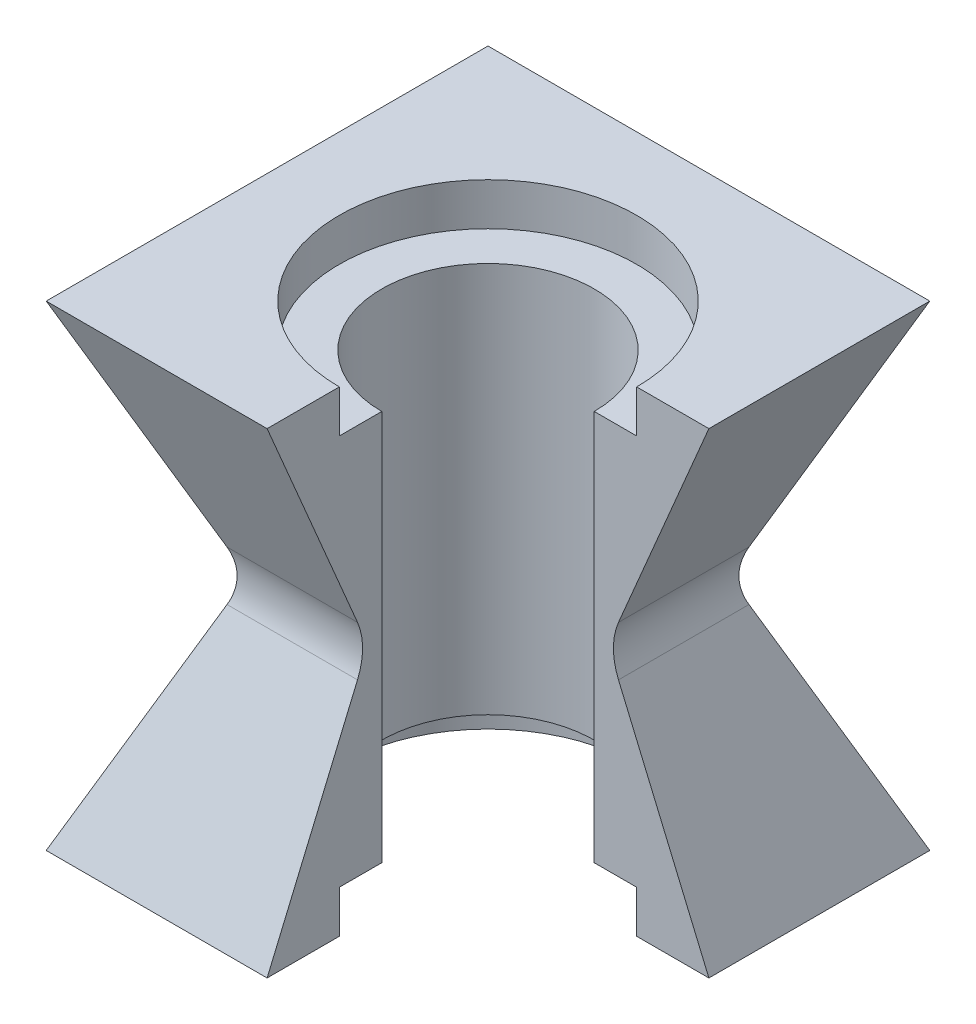
from build123d import *

# Parameters (mm, degrees)
ESQUISSE1_W                  = 104
ESQUISSE1_H                  = 104
BOSS_EXTRU_2_DEPTH           = 56
BOSS_EXTRU_2_DRAFT           = -23
SYM_TRIE1_COPY_1_SKETCH_W    = 104
SYM_TRIE1_COPY_1_SKETCH_H    = 104
SYM_TRIE1_COPY_1_DEPTH       = 56
SYM_TRIE1_COPY_1_DRAFT       = -23
ENL_V_MAT_EXTRU_1_DEPTH      = 134.985073796
ENL_V_MAT_EXTRU_1_DEPTH_BACK = 134.985073796
ESQUISSE2_R                  = 25
CONG_1_R                     = 15
ESQUISSE3_W                  = 52
ESQUISSE3_H                  = 52
ENL_V_MAT_EXTRU_2_DEPTH      = 134.985073796
ESQUISSE4_R                  = 35
ENL_V_MAT_EXTRU_3_DEPTH      = 10


with BuildPart() as part:
    # Esquisse1 → Boss.-Extru.2 (with draft: the straight prism first)
    with BuildSketch(Plane(origin=(0, 0, 0), x_dir=(1, 0, 0), z_dir=(0, 1, 0))):
        Rectangle(ESQUISSE1_W, ESQUISSE1_H)
    extrude(amount=-BOSS_EXTRU_2_DEPTH)
    # Boss.-Extru.2: the draft: its side faces are tilted about the plane it starts from
    boss_extru_2_sides = [part.faces().sort_by_distance(p)[0] for p in [
        (-52, -28, 0),
        (0, -28, 52),
        (52, -28, 0),
        (0, -28, -52),
    ]]
    draft(boss_extru_2_sides, Plane(origin=(0, 0, 0), x_dir=(1, 0, 0), z_dir=(0, 1, 0)), BOSS_EXTRU_2_DRAFT)


with BuildPart() as sym_trie1_copy_1_tool:
    # Symétrie1 copy 1 sketch → Symétrie1 copy 1 (with draft: the straight prism first)
    with BuildSketch(Plane.XZ.offset(112)):
        Rectangle(SYM_TRIE1_COPY_1_SKETCH_W, SYM_TRIE1_COPY_1_SKETCH_H)
    extrude(amount=-SYM_TRIE1_COPY_1_DEPTH)
    # Symétrie1 copy 1: the draft: its side faces are tilted about the plane it starts from
    sym_trie1_copy_1_sides = [sym_trie1_copy_1_tool.faces().sort_by_distance(p)[0] for p in [
        (-52, -84, 0),
        (0, -84, 52),
        (52, -84, 0),
        (0, -84, -52),
    ]]
    draft(sym_trie1_copy_1_sides, Plane.XZ.offset(112), SYM_TRIE1_COPY_1_DRAFT)


with BuildPart() as part_1:
    add(part.part)

    # Symétrie1 copy 1: add sym_trie1_copy_1_tool
    add(sym_trie1_copy_1_tool.part)

    # Esquisse2 → Enlèv. mat.-Extru.1 (cut, two sides: drawn at the far end of the back side and taken through both)
    with BuildSketch(Plane(origin=(0, 0, 0), x_dir=(1, 0, 0), z_dir=(0, 1, 0)).offset(-ENL_V_MAT_EXTRU_1_DEPTH_BACK)):
        with Locations(Location((0, 0, 0), (0, 0, 270))):
            Circle(ESQUISSE2_R)
    extrude(amount=ENL_V_MAT_EXTRU_1_DEPTH + ENL_V_MAT_EXTRU_1_DEPTH_BACK, mode=Mode.SUBTRACT)

    # Congé1
    cong_1_edges = [part_1.edges().sort_by_distance(p)[0] for p in [
        (-28.229410292, -56, 0),
        (0, -56, 28.229410292),
        (28.229410292, -56, 0),
        (0, -56, -28.229410292),
    ]]
    fillet(cong_1_edges, radius=CONG_1_R)

    # Esquisse3 → Enlèv. mat.-Extru.2 (cut, through all)
    with BuildSketch(Plane(origin=(0, 0, 0), x_dir=(1, 0, 0), z_dir=(0, 1, 0))):
        with Locations((26, -26)):
            Rectangle(ESQUISSE3_W, ESQUISSE3_H)
    extrude(amount=-ENL_V_MAT_EXTRU_2_DEPTH, mode=Mode.SUBTRACT)

    # Esquisse4 → Enlèv. mat.-Extru.3 (cut)
    with BuildSketch(Plane(origin=(0, 0, 0), x_dir=(1, 0, 0), z_dir=(0, 1, 0))):
        Circle(ESQUISSE4_R)
    enl_v_mat_extru_3 = extrude(amount=-ENL_V_MAT_EXTRU_3_DEPTH, mode=Mode.SUBTRACT)

    # Symétrie2: Enlèv. mat.-Extru.3 across plane
    add(enl_v_mat_extru_3.mirror(Plane.ZX.offset(-56)), mode=Mode.SUBTRACT)


solid = part_1.part
